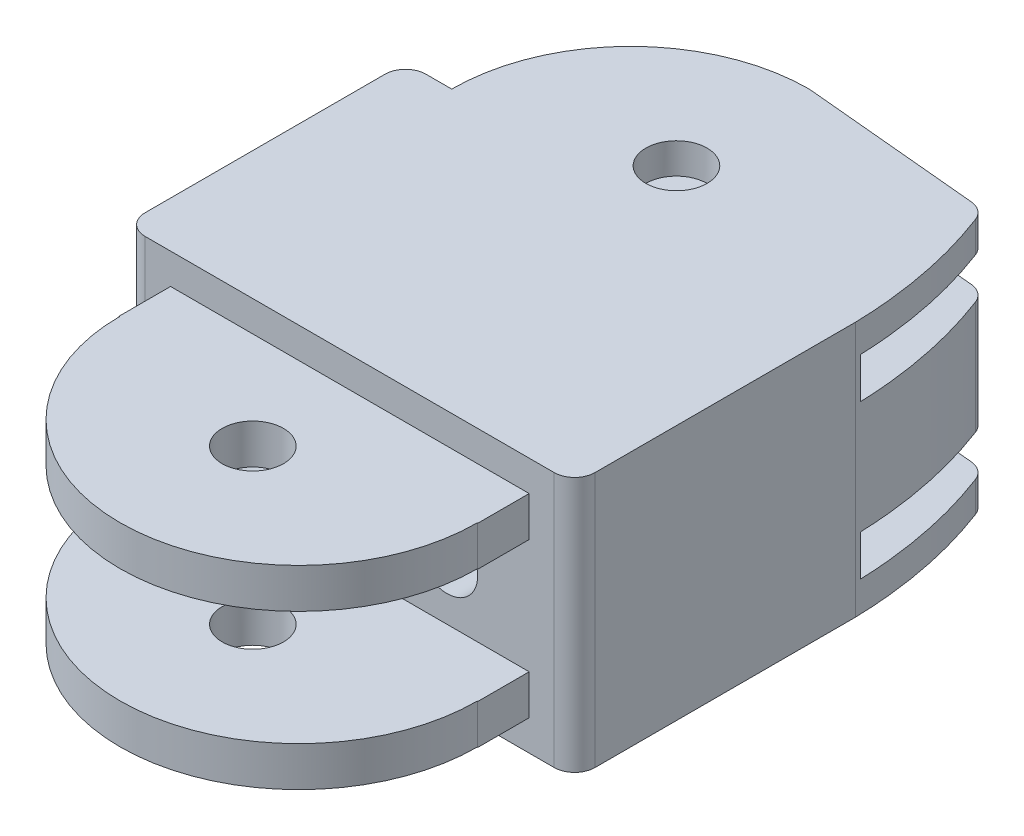
from build123d import *

# Parameters (mm, degrees)
SKETCH2_W             = 17.554431489
SKETCH2_H             = 1.95
BOSS_EXTRUDE1_DEPTH   = 8.75
BOSS_EXTRUDE1_2_DEPTH = 8.75
CUT_EXTRUDE1_DEPTH    = 26.518349076
SKETCH4_W             = 22.027215745
SKETCH4_H             = 12.505427167
BOSS_EXTRUDE2_DEPTH   = 25
SKETCH5_R             = 1.5
CUT_EXTRUDE2_DEPTH    = 12
SKETCH6_W             = 22.027215745
SKETCH6_H             = 12.505427167
SKETCH6_W_2           = 17.554431489
SKETCH6_H_2           = 1.95
CUT_EXTRUDE3_DEPTH    = 2.5
SKETCH7_R             = 1.5
CUT_EXTRUDE4_DEPTH    = 13
SKETCH8_R             = 1.5
CUT_EXTRUDE5_DEPTH    = 28
FILLET3_R             = 1
SKETCH9_W             = 22.02721574
SKETCH9_H             = 2
CUT_EXTRUDE6_DEPTH    = 16


with BuildPart() as part:
    # Sketch2 → Boss-Extrude1 (new body)
    with BuildSketch(Plane.XY):
        with Locations((-13.228930986, -27.845183414)):
            Rectangle(SKETCH2_W, SKETCH2_H)
    extrude(amount=BOSS_EXTRUDE1_DEPTH)


with BuildPart() as body_2:
    # Sketch2 → Boss-Extrude1 2 (new body)
    with BuildSketch(Plane.XY):
        with Locations((-13.228930986, -20.289756247)):
            Rectangle(SKETCH2_W, SKETCH2_H)
    extrude(amount=BOSS_EXTRUDE1_2_DEPTH)


with BuildPart() as cut_extrude1_tool:
    # Sketch3 → Cut-Extrude1 (new, through all)
    with BuildSketch(Plane(origin=(0, -19.314756247, 0), x_dir=(1, 0, 0), z_dir=(0, 1, 0))):
        with BuildLine():
            ThreePointArc((-13.228930986, -8.75), (-7.041746651, -6.187184335), (-4.478930986, 0))
            add(Edge.make_bspline(
                [(-4.478930986, 0), (1.138349918, -4.151657709), (-4.451715242, -8.75)],
                knots=[0, 0, 0, 1, 1, 1], degree=2))
            add(Edge.make_bspline(
                [(-22.006146731, -8.75), (-13.228930986, -12.473510392), (-4.451715242, -8.75)],
                knots=[0, 0, 0, 1, 1, 1], degree=2))
            add(Edge.make_bspline(
                [(-21.978930986, 0), (-25.926969228, -4.242865138), (-22.006146731, -8.75)],
                knots=[0, 0, 0, 1, 1, 1], degree=2))
            ThreePointArc((-21.978930986, 0), (-19.416115322, -6.187184335), (-13.228930986, -8.75))
        make_face()
    extrude(amount=-CUT_EXTRUDE1_DEPTH)


with BuildPart() as part_1:
    add(part.part)

    # Cut-Extrude1: cut by cut_extrude1_tool
    add(cut_extrude1_tool.part, mode=Mode.SUBTRACT)



with BuildPart() as body_2_1:
    add(body_2.part)

    # Cut-Extrude1: cut by cut_extrude1_tool
    add(cut_extrude1_tool.part, mode=Mode.SUBTRACT)


with BuildPart() as part_2:
    add(part_1.part)

    add(body_2_1.part)  # Boss-Extrude2 merges body 2
    # Sketch4 → Boss-Extrude2 (add)
    with BuildSketch(Plane(origin=(0, 0, 0), x_dir=(-1, 0, 0), z_dir=(0, 0, -1))):
        with Locations((13.242538859, -24.067469831)):
            Rectangle(SKETCH4_W, SKETCH4_H)
    extrude(amount=BOSS_EXTRUDE2_DEPTH)

    # Sketch5 → Cut-Extrude2 (cut)
    with BuildSketch(Plane(origin=(0, -19.314756247, 0), x_dir=(1, 0, 0), z_dir=(0, 1, 0))):
        with Locations(Location((-13.228930986, -2.25, 0), (0, 0, 270))):
            Circle(SKETCH5_R)
    extrude(amount=-CUT_EXTRUDE2_DEPTH, mode=Mode.SUBTRACT)

    # Sketch6 → Cut-Extrude3 (cut)
    with BuildSketch(Plane.XY):
        with Locations((-13.242538859, -24.067469831)):
            Rectangle(SKETCH6_W, SKETCH6_H)
        with Locations((-13.228930986, -27.845183414)):
            Rectangle(SKETCH6_W_2, SKETCH6_H_2, mode=Mode.SUBTRACT)
        with Locations((-13.228930986, -20.289756247)):
            Rectangle(SKETCH6_W_2, SKETCH6_H_2, mode=Mode.SUBTRACT)
    extrude(amount=-CUT_EXTRUDE3_DEPTH, mode=Mode.SUBTRACT)

    # Sketch7 → Cut-Extrude4 (cut)
    with BuildSketch(Plane(origin=(0, -17.814756247, 0), x_dir=(1, 0, 0), z_dir=(0, 1, 0))):
        with Locations(Location((-13.242538859, 18.5, 0), (0, 0, 270))):
            Circle(SKETCH7_R)
        with BuildLine():
            Line((-21.992538859, 16.25), (-24.256146731, 16.25))
            add(Edge.make_bspline(
                [(-24.256146731, 16.25), (-34.36884236, 22.178246018), (-14.712267615, 52.032901089), (16.629341759, 22.46378621), (-2.228930986, 16.25)],
                knots=[0, 0, 0, 0, 0.431250879, 1, 1, 1, 1], degree=3))
            add(Edge.make_bspline(
                [(-3.881799271, 24.128638582), (-2.328777172, 20.372571126), (-2.228930986, 16.25)],
                knots=[0, 0, 0, 1, 1, 1], degree=2))
            Line((-3.881799271, 24.128638582), (-13.242538859, 25))
            ThreePointArc((-13.242538859, 25), (-19.429723194, 22.437184335), (-21.992538859, 16.25))
        make_face()
    extrude(amount=-CUT_EXTRUDE4_DEPTH, mode=Mode.SUBTRACT)

    # Sketch8 → Cut-Extrude5 (cut)
    with BuildSketch(Plane.XY.offset(-2.5)):
        with Locations((-18.011106811, -24.06746983)):
            Circle(SKETCH8_R)
        with Locations((-8.473970906, -24.06746983)):
            Circle(SKETCH8_R)
    extrude(amount=-CUT_EXTRUDE5_DEPTH, mode=Mode.SUBTRACT)

    # Fillet3
    fillet3_edges = [part_2.edges().sort_by_distance(p)[0] for p in [
        (-24.256146731, -24.06746983, -2.5),
        (-24.256146731, -24.06746983, -16.25),
        (-2.228930986, -24.06746983, -2.5),
        (-3.881799271, -24.06746983, -24.128638582),
    ]]
    fillet(fillet3_edges, radius=FILLET3_R)

    # Sketch9 → Cut-Extrude6 (cut)
    with BuildSketch(Plane.XY.offset(-32.5)):
        with Locations((-13.24253886, -20.31475625)):
            Rectangle(SKETCH9_W, SKETCH9_H)
        with Locations((-13.24253886, -27.836055834)):
            Rectangle(SKETCH9_W, SKETCH9_H)
    extrude(amount=CUT_EXTRUDE6_DEPTH, mode=Mode.SUBTRACT)


solid = part_2.part
